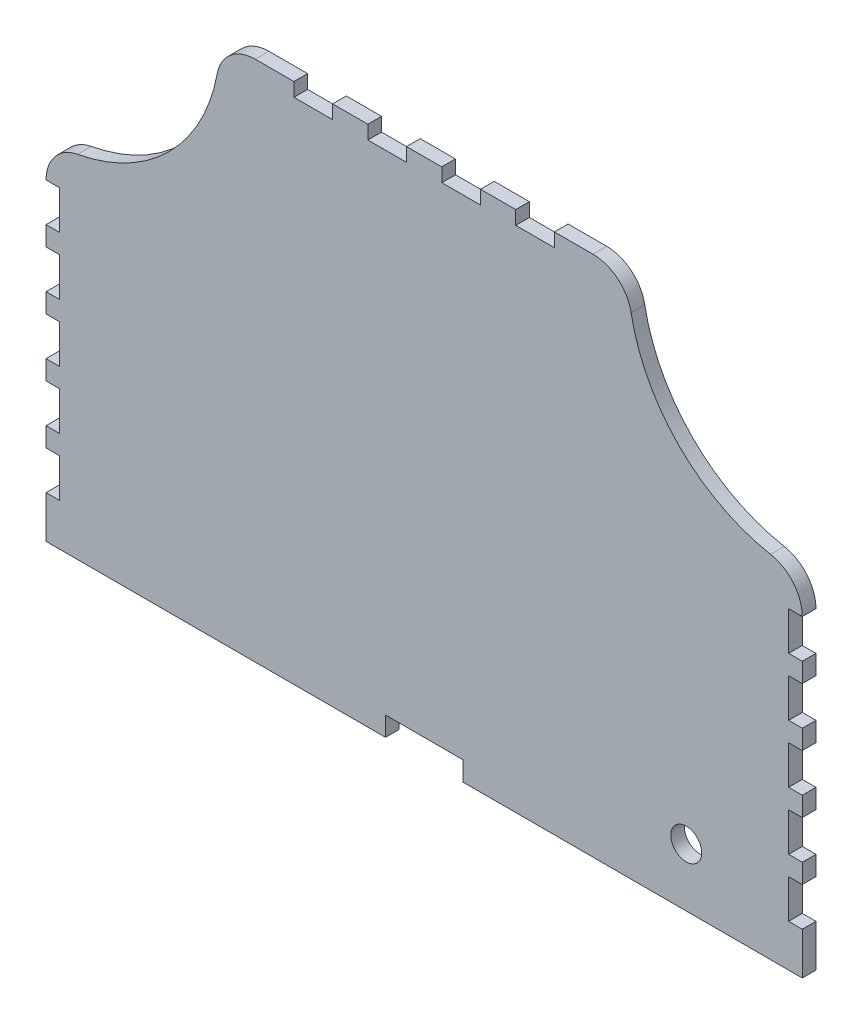
from build123d import *

# Parameters (mm, degrees)
BOSS_EXTRUDE1_DEPTH = 4.4958
FILLET1_R           = 12.7
SKETCH2_W           = 4.4958
SKETCH2_H           = 12.7
CUT_EXTRUDE1_DEPTH  = 302.762747772
SKETCH3_W           = 12.7
SKETCH3_H           = 4.4958
CUT_EXTRUDE2_DEPTH  = 302.762747772
SKETCH4_R           = 5.08
CUT_EXTRUDE3_DEPTH  = 302.762747772
SKETCH5_W           = 25.4
SKETCH5_H           = 6.35
CUT_EXTRUDE4_DEPTH  = 302.762747772


with BuildPart() as part:
    # Sketch1 → Boss-Extrude1 (new body)
    with BuildSketch(Plane.XY):
        with BuildLine():
            Line((0, 114.3), (0, 0))
            Line((0, 0), (248.285, 0))
            Line((248.285, 0), (248.285, 114.3))
            ThreePointArc((248.285, 114.3), (207.873847455, 131.038847455), (191.135, 171.45))
            Line((191.135, 171.45), (57.15, 171.45))
            ThreePointArc((57.15, 171.45), (40.411152545, 131.038847455), (0, 114.3))
        make_face()
    extrude(amount=BOSS_EXTRUDE1_DEPTH)

    # Fillet1
    fillet1_edges = [part.edges().sort_by_distance(p)[0] for p in [
        (248.285, 114.3, 2.2479),
        (0, 114.3, 2.2479),
        (57.15, 171.45, 2.2479),
        (191.135, 171.45, 2.2479),
    ]]
    fillet(fillet1_edges, radius=FILLET1_R)

    # Sketch2 → Cut-Extrude1 (cut, through all)
    with BuildSketch(Plane.XY.offset(4.4958)):
        with Locations((246.0371, 96.414248202)):
            Rectangle(SKETCH2_W, SKETCH2_H)
        with Locations((246.0371, 77.364248202)):
            Rectangle(SKETCH2_W, SKETCH2_H)
        with Locations((246.0371, 39.264248202)):
            Rectangle(SKETCH2_W, SKETCH2_H)
        with Locations((246.0371, 58.314248202)):
            Rectangle(SKETCH2_W, SKETCH2_H)
        with Locations((246.0371, 20.214248202)):
            Rectangle(SKETCH2_W, SKETCH2_H)
        with Locations((2.2479, 96.414248202)):
            Rectangle(SKETCH2_W, SKETCH2_H)
        with Locations((2.2479, 77.364248202)):
            Rectangle(SKETCH2_W, SKETCH2_H)
        with Locations((2.2479, 58.314248202)):
            Rectangle(SKETCH2_W, SKETCH2_H)
        with Locations((2.2479, 39.264248202)):
            Rectangle(SKETCH2_W, SKETCH2_H)
        with Locations((2.2479, 20.214248202)):
            Rectangle(SKETCH2_W, SKETCH2_H)
    extrude(amount=-CUT_EXTRUDE1_DEPTH, mode=Mode.SUBTRACT)

    # Sketch3 → Cut-Extrude2 (cut, through all)
    with BuildSketch(Plane.XY.offset(4.4958)):
        with Locations((112.006917266, 169.2021)):
            Rectangle(SKETCH3_W, SKETCH3_H)
        with Locations((87.735751798, 169.2021)):
            Rectangle(SKETCH3_W, SKETCH3_H)
        with Locations((136.278082734, 169.2021)):
            Rectangle(SKETCH3_W, SKETCH3_H)
        with Locations((160.549248202, 169.2021)):
            Rectangle(SKETCH3_W, SKETCH3_H)
    extrude(amount=-CUT_EXTRUDE2_DEPTH, mode=Mode.SUBTRACT)

    # Sketch4 → Cut-Extrude3 (cut, through all)
    with BuildSketch(Plane.XY.offset(4.4958)):
        with Locations((210.185, 19.05)):
            Circle(SKETCH4_R)
    extrude(amount=-CUT_EXTRUDE3_DEPTH, mode=Mode.SUBTRACT)

    # Sketch5 → Cut-Extrude4 (cut, through all)
    with BuildSketch(Plane.XY.offset(4.4958)):
        with Locations((124.1425, 3.175)):
            Rectangle(SKETCH5_W, SKETCH5_H)
    extrude(amount=-CUT_EXTRUDE4_DEPTH, mode=Mode.SUBTRACT)


solid = part.part
